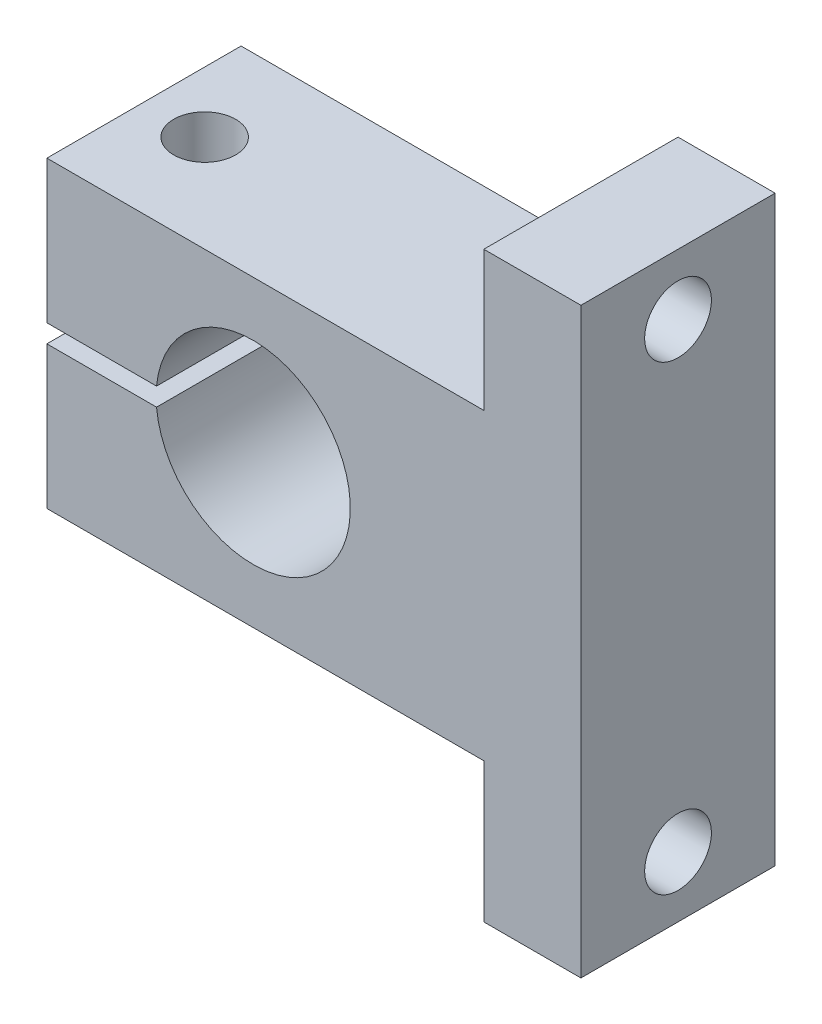
from build123d import *

# Parameters (mm, degrees)
EXTRUS_O1_DEPTH               = 16
EXTRUS_O2_REACH               = 61.365
ESBO_O2_R                     = 2.55
FURO_ROSCADO_DE_M5X0_82_D     = 4.2
FURO_ROSCADO_DE_M5X0_82_DEPTH = 14
FURO_ROSCADO_DE_M5X0_82_TIP   = 1.2618073
ESBO_O5_R                     = 2.75
EXTRUS_O3_DEPTH               = 63.096698785


with BuildPart() as part:
    # Esboço1 → Extrusão1 (new body)
    with BuildSketch(Plane.XY):
        with BuildLine():
            Line((0, 0), (0, 48))
            Line((0, 48), (-8, 48))
            Line((-8, 48), (-8, 36.5))
            Line((-8, 36.5), (-44, 36.5))
            Line((-44, 36.5), (-44, 24.75))
            Line((-44, 24.75), (-34.964766161, 24.75))
            ThreePointArc((-34.964766161, 24.75), (-19, 24), (-34.964766161, 23.25))
            Line((-34.964766161, 23.25), (-44, 23.25))
            Line((-44, 23.25), (-44, 11.5))
            Line((-44, 11.5), (-8, 11.5))
            Line((-8, 11.5), (-8, 0))
            Line((-8, 0), (0, 0))
        make_face()
    extrude(amount=EXTRUS_O1_DEPTH)

    # Esboço2 → Extrusão2 (cut, up to next)
    with BuildSketch(Plane(origin=(0, 36.5, 0), x_dir=(1, 0, 0), z_dir=(0, 1, 0)), mode=Mode.PRIVATE) as extrus_o2_sk1:
        with Locations(Location((-39, -8, 0), (0, 0, 270))):
            Circle(ESBO_O2_R)
    extrus_o2_tool1 = extrude(extrus_o2_sk1.sketch, amount=-EXTRUS_O2_REACH, mode=Mode.PRIVATE) & part.part
    add(extrus_o2_tool1.solids().sort_by_distance((-39, 36.5, 8))[0], mode=Mode.SUBTRACT)

    # Furo roscado de M5x0.82
    with Locations(Plane(origin=(-39, 23.25, 8), x_dir=(1, 0, 0), z_dir=(0, 1, 0))):
        with Locations((0, 0)):
            Hole(FURO_ROSCADO_DE_M5X0_82_D / 2, depth=FURO_ROSCADO_DE_M5X0_82_DEPTH)
            with Locations((0, 0, -(FURO_ROSCADO_DE_M5X0_82_DEPTH + FURO_ROSCADO_DE_M5X0_82_TIP / 2))):  # 118° drill point
                Cone(0, FURO_ROSCADO_DE_M5X0_82_D / 2, FURO_ROSCADO_DE_M5X0_82_TIP, mode=Mode.SUBTRACT)

    # Esboço5 → Extrusão3 (cut, through all)
    with BuildSketch(Plane.ZY.offset(8)):
        with Locations(Location((8, 43, 0), (0, 0, 270))):
            Circle(ESBO_O5_R)
        with Locations(Location((8, 5, 0), (0, 0, 270))):
            Circle(ESBO_O5_R)
    extrude(amount=-EXTRUS_O3_DEPTH, mode=Mode.SUBTRACT)


solid = part.part
